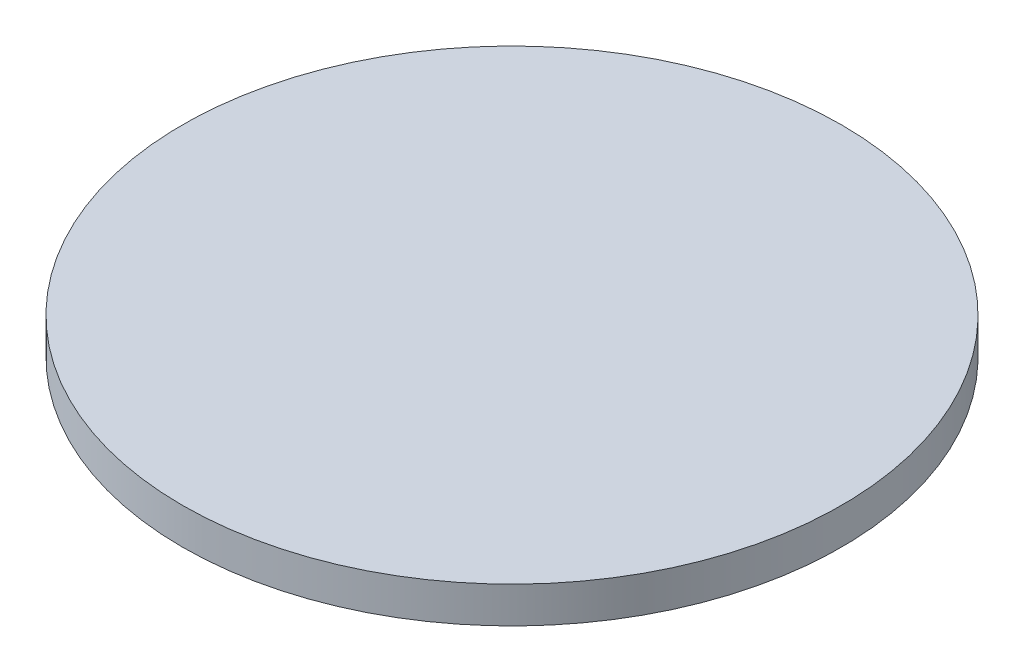
from build123d import *

# Parameters (mm, degrees)
SKETCH1_R           = 27.3
BOSS_EXTRUDE1_DEPTH = 3


with BuildPart() as part:
    # Sketch1 → Boss-Extrude1 (new body)
    with BuildSketch(Plane(origin=(0, 0, 0), x_dir=(1, 0, 0), z_dir=(0, 1, 0))):
        with Locations(Location((0, 0, 0), (0, 0, 270))):
            Circle(SKETCH1_R)
    extrude(amount=BOSS_EXTRUDE1_DEPTH)


solid = part.part
